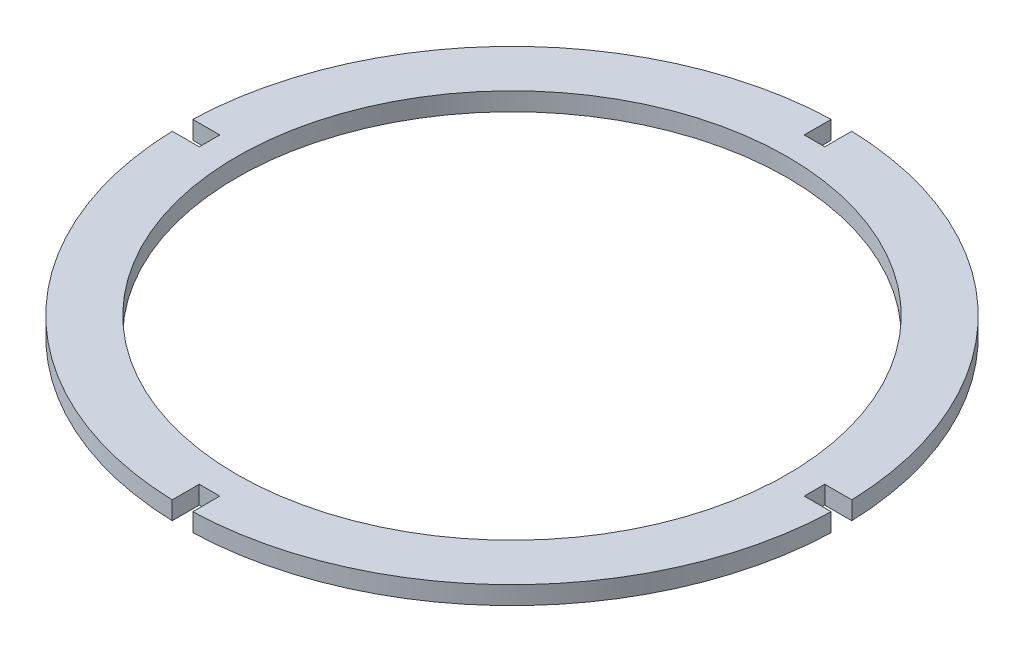
from build123d import *

# Parameters (mm, degrees)
SKETCH1_R           = 45.5
BOSS_EXTRUDE1_DEPTH = 1.5


with BuildPart() as part:
    # Sketch1 → Boss-Extrude1 (new, symmetric)
    with BuildSketch(Plane(origin=(0, 0, 0), x_dir=(1, 0, 0), z_dir=(0, 1, 0))):
        with BuildLine():
            Line((-1.7, 54.473479786), (-1.7, 50))
            Line((-1.7, 50), (1.7, 50))
            Line((1.7, 50), (1.7, 54.473479786))
            ThreePointArc((1.7, 54.473479786), (38.537319575, 38.537319575), (54.473479786, 1.7))
            Line((54.473479786, 1.7), (50, 1.7))
            Line((50, 1.7), (50, -1.7))
            Line((50, -1.7), (54.473479786, -1.7))
            ThreePointArc((54.473479786, -1.7), (38.537319575, -38.537319575), (1.7, -54.473479786))
            Line((1.7, -54.473479786), (1.7, -50))
            Line((1.7, -50), (-1.7, -50))
            Line((-1.7, -50), (-1.7, -54.473479786))
            ThreePointArc((-1.7, -54.473479786), (-38.537319575, -38.537319575), (-54.473479786, -1.7))
            Line((-54.473479786, -1.7), (-50, -1.7))
            Line((-50, -1.7), (-50, 1.7))
            Line((-50, 1.7), (-54.473479786, 1.7))
            ThreePointArc((-54.473479786, 1.7), (-38.537319575, 38.537319575), (-1.7, 54.473479786))
        make_face()
        with Locations(Location((0, 0, 0), (0, 0, 270))):
            Circle(SKETCH1_R, mode=Mode.SUBTRACT)
    extrude(amount=BOSS_EXTRUDE1_DEPTH, both=True)


solid = part.part
